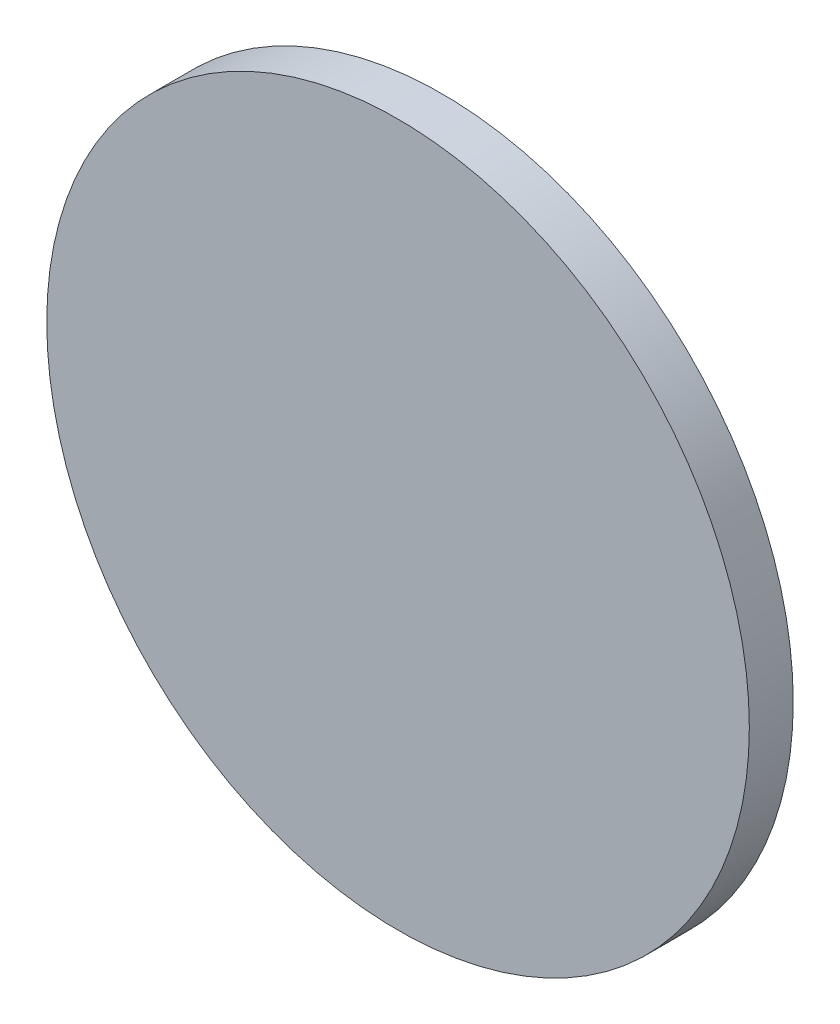
from build123d import *

# Parameters (mm, degrees)
SKETCH1_R           = 120
BOSS_EXTRUDE1_DEPTH = 15


with BuildPart() as part:
    # Sketch1 → Boss-Extrude1 (new body)
    with BuildSketch(Plane.XY):
        Circle(SKETCH1_R)
    extrude(amount=BOSS_EXTRUDE1_DEPTH)


solid = part.part
